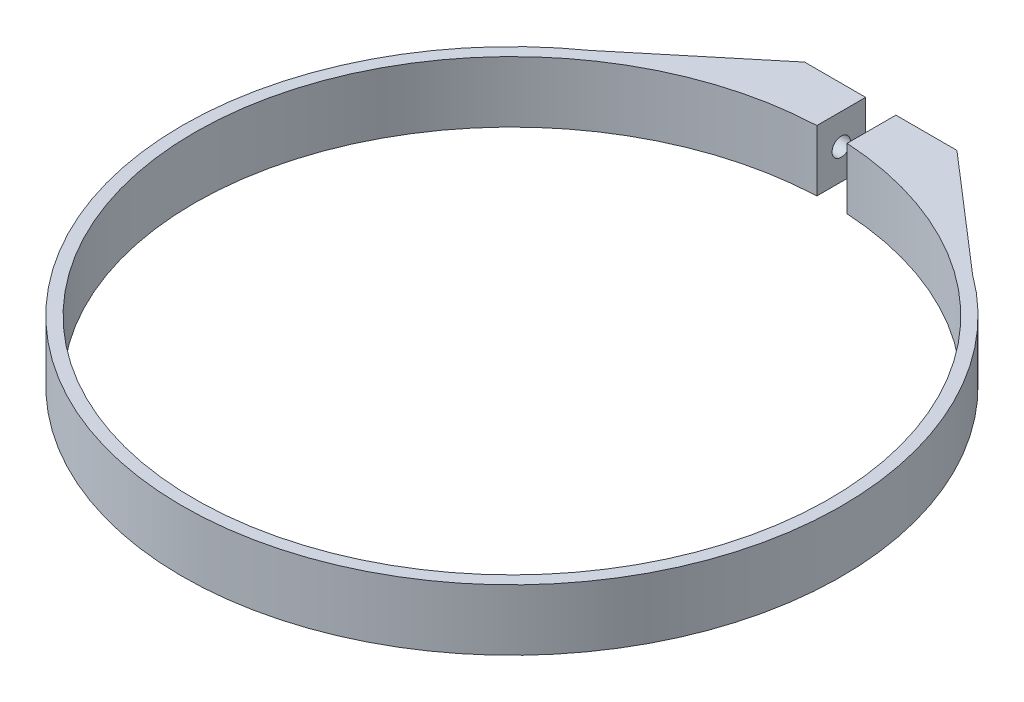
from build123d import *

# Parameters (mm, degrees)
BOSS_EXTRUDE1_DEPTH                                = 10
SKETCH2_W                                          = 52
SKETCH2_H                                          = 10
SKETCH3_W                                          = 1.25
SKETCH3_H                                          = 51.010277138
CBORE_FOR_M2_5_HEX_HEAD_MACHINE_SCREW1_D           = 3
CBORE_FOR_M2_5_HEX_HEAD_MACHINE_SCREW1_DEPTH       = 73.865916176
CBORE_FOR_M2_5_HEX_HEAD_MACHINE_SCREW1_CBORE_D     = 5
CBORE_FOR_M2_5_HEX_HEAD_MACHINE_SCREW1_CBORE_DEPTH = 12.855639038


with BuildPart() as part:
    # Sketch1 → Boss-Extrude1 (new body)
    with BuildSketch(Plane(origin=(0, 10, 0), x_dir=(1, 0, 0), z_dir=(0, 1, 0))):
        with BuildLine():
            Line((2.989722862, 59.91398229), (2.989722862, 51.91398229))
            ThreePointArc((2.989722862, 51.91398229), (0.490289866, 51.997688563), (-2.010277138, 51.961127642))
            Line((-2.010277138, 51.961127642), (-2.010277138, 59.961127642))
            Line((-2.010277138, 59.961127642), (-12.010277138, 59.961127642))
            Line((-12.010277138, 59.961127642), (-31.271602572, 44.023708074))
            ThreePointArc((-31.271602572, 44.023708074), (-0.39031945, -53.99858934), (31.904737187, 43.567048844))
            Line((31.904737187, 43.567048844), (12.989722862, 59.91398229))
            Line((12.989722862, 59.91398229), (2.989722862, 59.91398229))
        make_face()
    extrude(amount=-BOSS_EXTRUDE1_DEPTH)

    # Sketch2 → Cut-Revolve1 (revolve, cut)
    with BuildSketch(Plane.XY):
        with Locations((26, 5)):
            Rectangle(SKETCH2_W, SKETCH2_H)
    revolve(axis=Axis((0, 10, 0), (0, -1, 0)), mode=Mode.SUBTRACT)

    # Sketch3 → Ø2.5 (2.5) Diameter Hole1 (revolve, cut)
    with BuildSketch(Plane(origin=(2.989722862, 5, -55.91398229), x_dir=(0, 0, 1), z_dir=(0, 1, 0))):
        with Locations((0.625, 25.505138569)):
            Rectangle(SKETCH3_W, SKETCH3_H)
    revolve(axis=Axis((-3.360277138, 5, -55.91398229), (1, 0, 0)), mode=Mode.SUBTRACT)

    # CBORE for M2.5 Hex Head Machine Screw1
    with Locations(Plane.ZY.offset(19.865916176)):
        with Locations((-55.961127642, 5)):
            CounterBoreHole(CBORE_FOR_M2_5_HEX_HEAD_MACHINE_SCREW1_D / 2, CBORE_FOR_M2_5_HEX_HEAD_MACHINE_SCREW1_CBORE_D / 2, CBORE_FOR_M2_5_HEX_HEAD_MACHINE_SCREW1_CBORE_DEPTH, depth=CBORE_FOR_M2_5_HEX_HEAD_MACHINE_SCREW1_DEPTH)


solid = part.part
